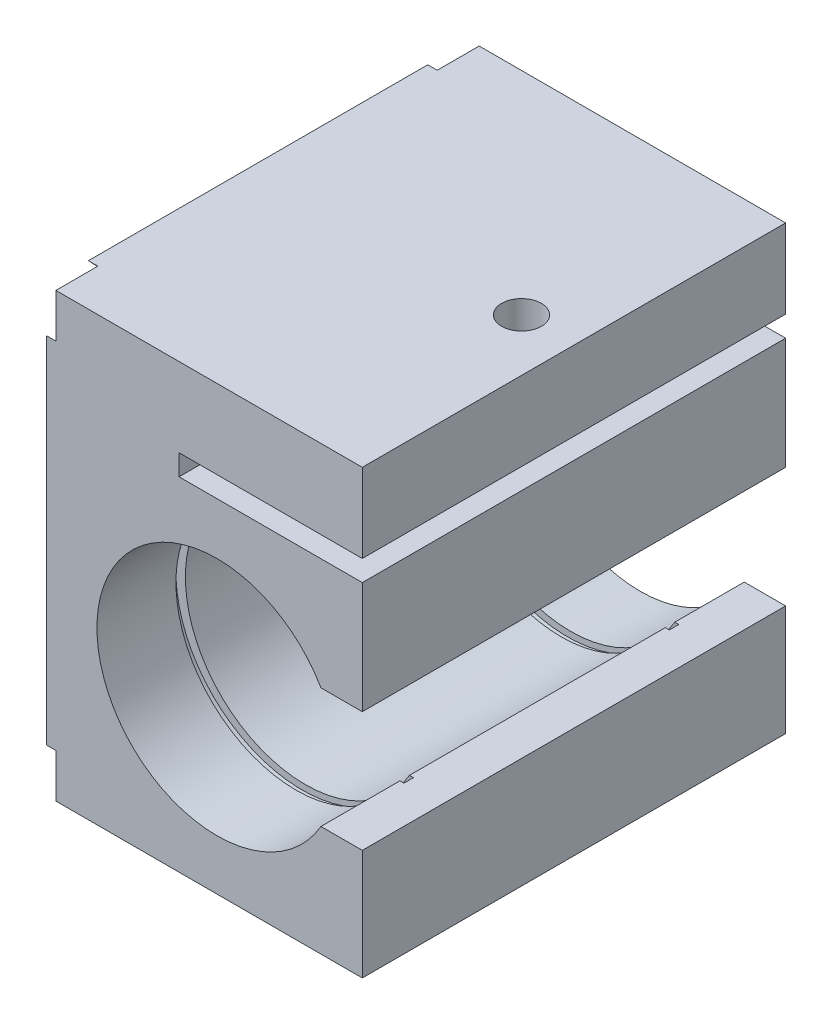
from build123d import *

# Parameters (mm, degrees)
BOSS_EXTRU_1_DEPTH         = 67
ENL_V_MAT_EXTRU_1_REACH    = 111.037
ESQUISSE2_R                = 3.15
ENL_V_MAT_EXTRU_3_DEPTH    = 1.5
ESQUISSE12_W               = 4.842495097
ESQUISSE12_H               = 1.5
R_P_TITION_LIN_AIRE1_COUNT = 2
R_P_TITION_LIN_AIRE1_PITCH = 42


with BuildPart() as part:
    # Esquisse1 → Boss.-Extru.1 (new body)
    with BuildSketch(Plane.XY):
        with BuildLine():
            Line((0, 0), (50, 0))
            Line((50, 0), (50, 17.5))
            Line((50, 17.5), (43.454482672, 17.5))
            ThreePointArc((43.454482672, 17.5), (8, 27), (43.454482672, 36.5))
            Line((43.454482672, 36.5), (50, 36.5))
            Line((50, 36.5), (50, 54.2))
            Line((50, 54.2), (21, 54.2))
            Line((21, 54.2), (21, 57.5))
            Line((21, 57.5), (50, 57.5))
            Line((50, 57.5), (50, 70))
            Line((50, 70), (0, 70))
            Line((0, 70), (0, 0))
        make_face()
    extrude(amount=BOSS_EXTRU_1_DEPTH)

    # Esquisse2 → Enlèv. mat.-Extru.1 (cut, up to next)
    with BuildSketch(Plane(origin=(0, 70, 0), x_dir=(1, 0, 0), z_dir=(0, 1, 0)), mode=Mode.PRIVATE) as enl_v_mat_extru_1_sk1:
        with Locations(Location((41.7, -33.5, 0), (0, 0, 270))):
            Circle(ESQUISSE2_R)
    enl_v_mat_extru_1_tool1 = extrude(enl_v_mat_extru_1_sk1.sketch, amount=-ENL_V_MAT_EXTRU_1_REACH, mode=Mode.PRIVATE) & part.part
    add(enl_v_mat_extru_1_tool1.solids().sort_by_distance((41.7, 70, 33.5))[0], mode=Mode.SUBTRACT)

    # Esquisse8 → Enlèv. mat.-Extru.3 (cut)
    with BuildSketch(Plane.ZY):
        Polygon((63.532395101, 73.318993261), (33.5, 41.941864051), (3.467604899, 73.318993261), (-3.467604899, 66.681006739), (26.855644409, 35), (-3.467604899, 3.318993261), (3.467604899, -3.318993261), (33.5, 28.058135949), (63.532395101, -3.318993261), (70.467604899, 3.318993261), (40.144355591, 35), (70.467604899, 66.681006739), align=None)
    extrude(amount=-ENL_V_MAT_EXTRU_3_DEPTH, mode=Mode.SUBTRACT)

    # Esquisse12 → Enlèvement de matière-Révolution2 (revolve, cut)
    with BuildSketch(Plane(origin=(0, 27, 0), x_dir=(1, 0, 0), z_dir=(0, 1, 0))):
        with Locations((44.070102797, -53.75)):
            Rectangle(ESQUISSE12_W, ESQUISSE12_H)
    enl_vement_de_mati_re_r_volution2 = revolve(axis=Axis((26.491350346, 27, 66.236309337), (0, 0, -1)), mode=Mode.SUBTRACT)

    # Répétition linéaire1: Enlèvement de matière-Révolution2 ×2
    with Locations(*[(0, 0, -i * R_P_TITION_LIN_AIRE1_PITCH) for i in range(1, R_P_TITION_LIN_AIRE1_COUNT)]):
        add(enl_vement_de_mati_re_r_volution2, mode=Mode.SUBTRACT)


solid = part.part
